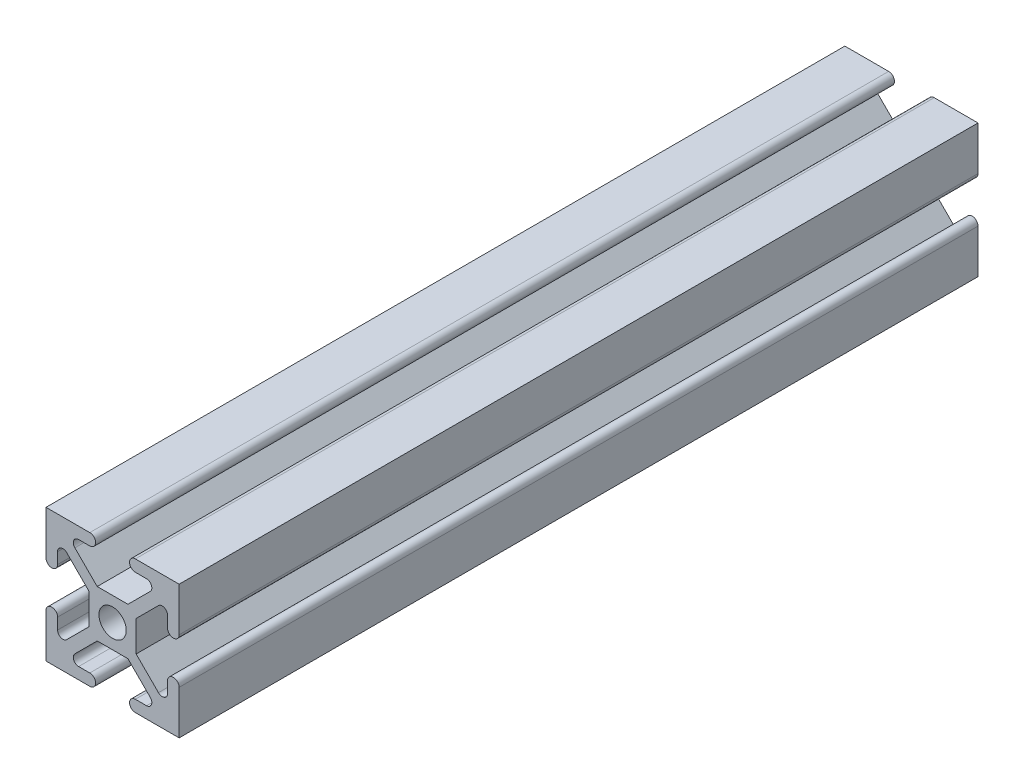
from build123d import *

# Parameters (mm, degrees)
SKETCH1_R           = 2.6035
BOSS_EXTRUDE1_DEPTH = 152.4


with BuildPart() as part:
    # Sketch1 → Boss-Extrude1 (new body)
    with BuildSketch(Plane.XY):
        with BuildLine():
            Line((-12.7, -12.7), (-4.343399971, -12.7))
            ThreePointArc((-4.343399971, -12.7), (-3.238499971, -11.5951), (-4.343399971, -10.4902))
            Line((-4.343399971, -10.4902), (-6.474794456, -10.4902))
            ThreePointArc((-6.474794456, -10.4902), (-7.413456061, -9.863006367), (-7.193214945, -8.75577951))
            Line((-7.193214945, -8.75577951), (-2.933235435, -4.4958))
            Line((-2.933235435, -4.4958), (2.933235435, -4.4958))
            Line((2.933235435, -4.4958), (7.193214945, -8.75577951))
            ThreePointArc((7.193214945, -8.75577951), (7.413456061, -9.863006367), (6.474794456, -10.4902))
            Line((6.474794456, -10.4902), (4.3434, -10.4902))
            ThreePointArc((4.3434, -10.4902), (3.2385, -11.5951), (4.3434, -12.7))
            Line((4.3434, -12.7), (12.7, -12.7))
            Line((12.7, -12.7), (12.7, -4.343399971))
            ThreePointArc((12.7, -4.343399971), (11.5951, -3.238499971), (10.4902, -4.343399971))
            Line((10.4902, -4.343399971), (10.4902, -6.474794456))
            ThreePointArc((10.4902, -6.474794456), (9.863006367, -7.413456061), (8.75577951, -7.193214945))
            Line((8.75577951, -7.193214945), (4.4958, -2.933235435))
            Line((4.4958, -2.933235435), (4.4958, 2.933235435))
            Line((4.4958, 2.933235435), (8.75577951, 7.193214945))
            ThreePointArc((8.75577951, 7.193214945), (9.863006367, 7.413456061), (10.4902, 6.474794456))
            Line((10.4902, 6.474794456), (10.4902, 4.3434))
            ThreePointArc((10.4902, 4.3434), (11.5951, 3.2385), (12.7, 4.3434))
            Line((12.7, 4.3434), (12.7, 12.7))
            Line((12.7, 12.7), (4.343399971, 12.7))
            ThreePointArc((4.343399971, 12.7), (3.238499971, 11.5951), (4.343399971, 10.4902))
            Line((4.343399971, 10.4902), (6.474794456, 10.4902))
            ThreePointArc((6.474794456, 10.4902), (7.413456061, 9.863006367), (7.193214945, 8.75577951))
            Line((7.193214945, 8.75577951), (2.933235435, 4.4958))
            Line((2.933235435, 4.4958), (-2.933235435, 4.4958))
            Line((-2.933235435, 4.4958), (-7.193214945, 8.75577951))
            ThreePointArc((-7.193214945, 8.75577951), (-7.413456061, 9.863006367), (-6.474794456, 10.4902))
            Line((-6.474794456, 10.4902), (-4.3434, 10.4902))
            ThreePointArc((-4.3434, 10.4902), (-3.2385, 11.5951), (-4.3434, 12.7))
            Line((-4.3434, 12.7), (-12.7, 12.7))
            Line((-12.7, 12.7), (-12.7, 4.343399971))
            ThreePointArc((-12.7, 4.343399971), (-11.5951, 3.238499971), (-10.4902, 4.343399971))
            Line((-10.4902, 4.343399971), (-10.4902, 6.474794456))
            ThreePointArc((-10.4902, 6.474794456), (-9.863006367, 7.413456061), (-8.75577951, 7.193214945))
            Line((-8.75577951, 7.193214945), (-4.4958, 2.933235435))
            Line((-4.4958, 2.933235435), (-4.4958, -2.933235435))
            Line((-4.4958, -2.933235435), (-8.75577951, -7.193214945))
            ThreePointArc((-8.75577951, -7.193214945), (-9.863006367, -7.413456061), (-10.4902, -6.474794456))
            Line((-10.4902, -6.474794456), (-10.4902, -4.3434))
            ThreePointArc((-10.4902, -4.3434), (-11.5951, -3.2385), (-12.7, -4.3434))
            Line((-12.7, -4.3434), (-12.7, -12.7))
        make_face()
        Circle(SKETCH1_R, mode=Mode.SUBTRACT)
    extrude(amount=-BOSS_EXTRUDE1_DEPTH)


solid = part.part
